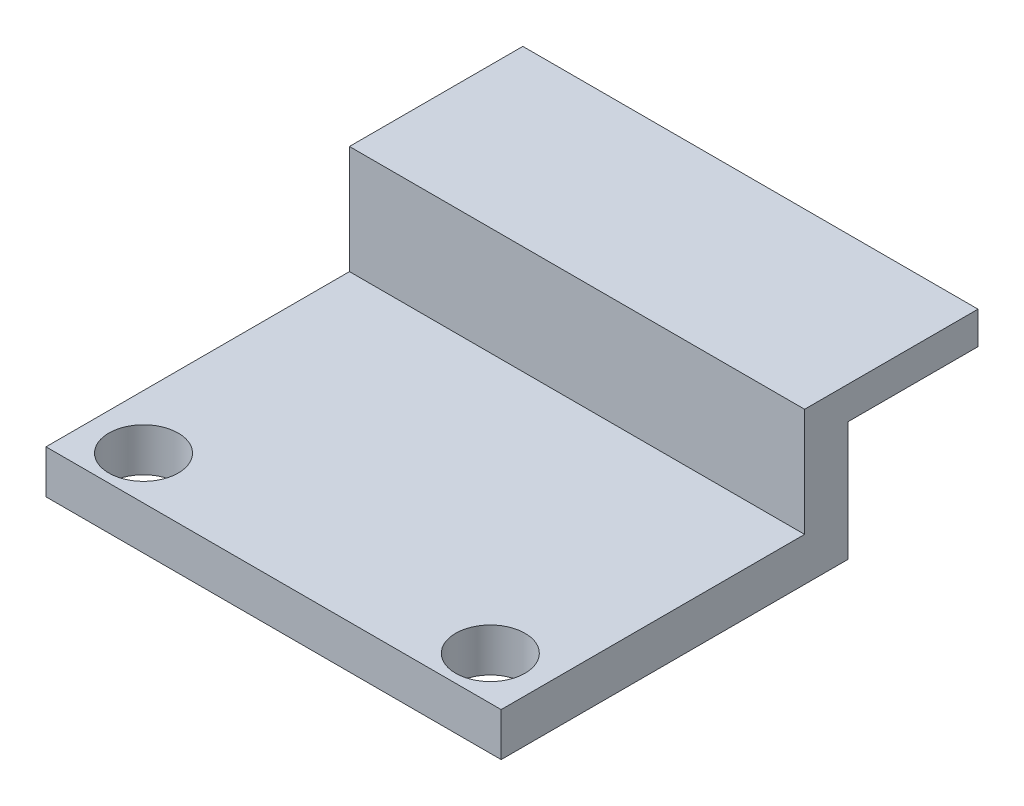
from build123d import *

# Parameters (mm, degrees)
SKETCH_1_W      = 21
SKETCH_1_H      = 16
SKETCH_1_R      = 1.6
EXTRUDE_1_DEPTH = 2
EXTRUDE_2_DEPTH = 21


with BuildPart() as part:
    # 草图1 → 凸台-拉伸1 (new body)
    with BuildSketch(Plane(origin=(0, 0, 0), x_dir=(1, 0, 0), z_dir=(0, 1, 0))):
        with Locations((10.5, 8)):
            Rectangle(SKETCH_1_W, SKETCH_1_H)
        with Locations(Location((18.5, 2, 0), (0, 0, 270))):
            Circle(SKETCH_1_R, mode=Mode.SUBTRACT)
        with Locations(Location((2.5, 2, 0), (0, 0, 90))):
            Circle(SKETCH_1_R, mode=Mode.SUBTRACT)
    extrude(amount=EXTRUDE_1_DEPTH)

    # 草图3 → 凸台-拉伸2 (add)
    with BuildSketch(Plane(origin=(21, 0, 0), x_dir=(0, 0, -1), z_dir=(1, 0, 0))):
        Polygon((16, 2), (14, 2), (14, 7), (22, 7), (22, 5.5), (16, 5.5), align=None)
    extrude(amount=-EXTRUDE_2_DEPTH)


solid = part.part
